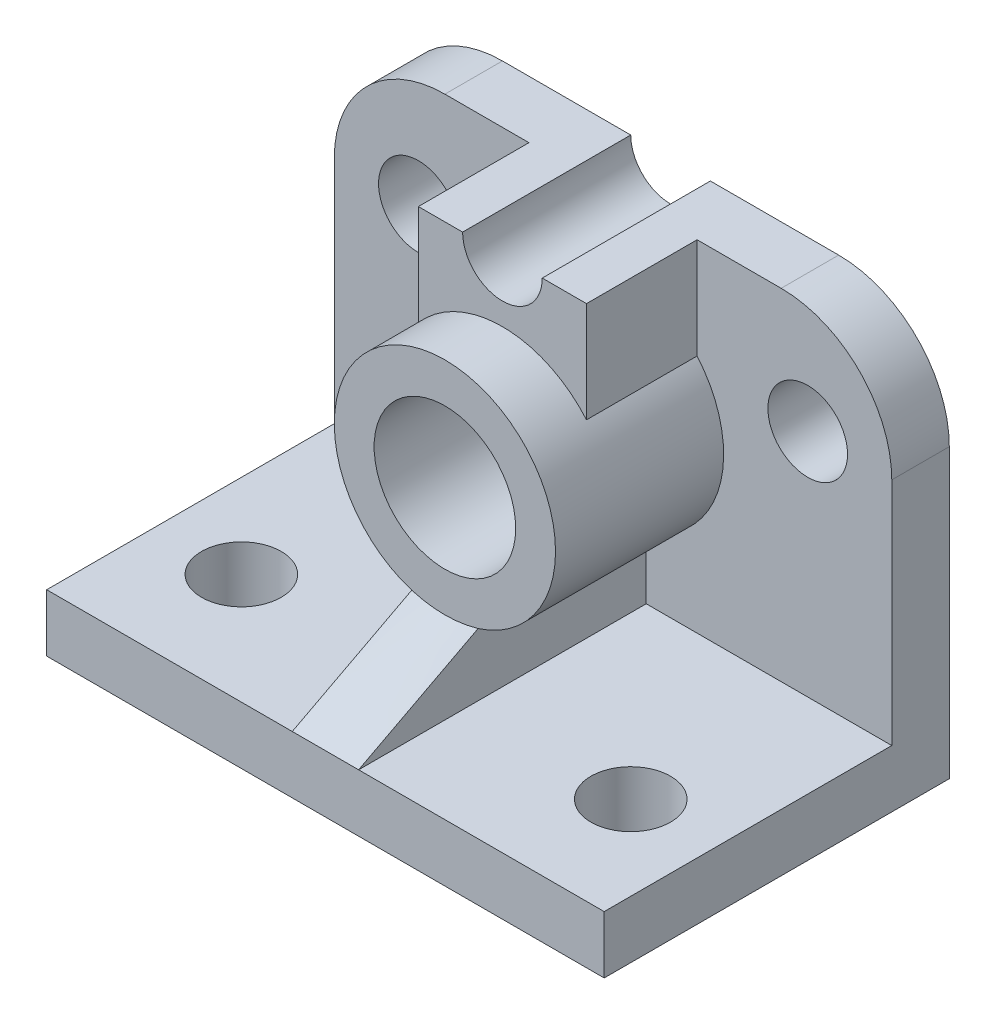
from build123d import *

# Parameters (mm, degrees)
SKETCH1_W               = 63
SKETCH1_H               = 13
BOSS_EXTRUDE1_DEPTH     = 78
BOSS_EXTRUDE2_DEPTH     = 51
BOSS_EXTRUDE3_DEPTH     = 13
BOSS_EXTRUDE5_DEPTH     = 38
FILLET1_R               = 25
CUT_EXTRUDE1_DEPTH      = 135.733069437
CUT_EXTRUDE1_DEPTH_BACK = 135.733069437
SKETCH3_R               = 9
CUT_EXTRUDE2_DEPTH      = 135.733069437
CUT_EXTRUDE2_DEPTH_BACK = 135.733069437
SKETCH2_R               = 9


with BuildPart() as part:
    # Sketch1 → Boss-Extrude1 (new body)
    with BuildSketch(Plane.XY):
        with Locations((-31.5, 6.5)):
            Rectangle(SKETCH1_W, SKETCH1_H)
        with Locations((31.5, 6.5)):
            Rectangle(SKETCH1_W, SKETCH1_H)
    extrude(amount=BOSS_EXTRUDE1_DEPTH)



with BuildPart() as body_2:
    # Sketch1<3> → Boss-Extrude2 (new body)
    with BuildSketch(Plane.XY):
        with BuildLine():
            ThreePointArc((-19, 67.248076809), (-22.706848309, 40.540600405), (0, 26))
            Line((0, 26), (0, 35))
            ThreePointArc((0, 35), (-16, 51), (0, 67))
            Line((0, 67), (0, 76))
            ThreePointArc((0, 76), (-10.459399595, 73.706848309), (-19, 67.248076809))
        make_face()
        with BuildLine():
            Line((0, 35), (0, 26))
            ThreePointArc((0, 26), (17.67766953, 33.32233047), (25, 51))
            ThreePointArc((25, 51), (23.452078799, 59.660254038), (19, 67.248076809))
            ThreePointArc((19, 67.248076809), (10.459399595, 73.706848309), (0, 76))
            Line((0, 76), (0, 67))
            ThreePointArc((0, 67), (11.313708499, 62.313708499), (16, 51))
            ThreePointArc((16, 51), (11.313708499, 39.686291501), (0, 35))
        make_face()
    extrude(amount=BOSS_EXTRUDE2_DEPTH)


with BuildPart() as part_1:
    add(part.part)

    add(body_2.part)  # Boss-Extrude3 merges body 2
    # Sketch1<5> → Boss-Extrude3 (add)
    with BuildSketch(Plane.XY):
        with BuildLine():
            Line((0, 13), (63, 13))
            Line((63, 13), (63, 90))
            Line((63, 90), (19, 90))
            Line((19, 90), (19, 67.248076809))
            ThreePointArc((19, 67.248076809), (23.452078799, 59.660254038), (25, 51))
            ThreePointArc((25, 51), (17.67766953, 33.32233047), (0, 26))
            Line((0, 26), (0, 13))
        make_face()
        with BuildLine():
            Line((-63, 13), (0, 13))
            Line((0, 13), (0, 26))
            ThreePointArc((0, 26), (-22.706848309, 40.540600405), (-19, 67.248076809))
            Line((-19, 67.248076809), (-19, 90))
            Line((-19, 90), (-63, 90))
            Line((-63, 90), (-63, 13))
        make_face()
    extrude(amount=BOSS_EXTRUDE3_DEPTH)

    # Sketch1<7> → Boss-Extrude5 (add)
    with BuildSketch(Plane.XY):
        with BuildLine():
            Line((-19, 90), (-19, 67.248076809))
            ThreePointArc((-19, 67.248076809), (-10.459399595, 73.706848309), (0, 76))
            Line((0, 76), (0, 81))
            ThreePointArc((0, 81), (-6.363961031, 83.636038969), (-9, 90))
            Line((-9, 90), (-19, 90))
        make_face()
        with BuildLine():
            Line((19, 67.248076809), (19, 90))
            Line((19, 90), (9, 90))
            ThreePointArc((9, 90), (6.363961031, 83.636038969), (0, 81))
            Line((0, 81), (0, 76))
            ThreePointArc((0, 76), (10.459399595, 73.706848309), (19, 67.248076809))
        make_face()
    extrude(amount=BOSS_EXTRUDE5_DEPTH)

    # Fillet1
    fillet1_edges = [part_1.edges().sort_by_distance(p)[0] for p in [
        (-63, 90, 6.5),
        (63, 90, 6.5),
    ]]
    fillet(fillet1_edges, radius=FILLET1_R)

    # Sketch3 → Cut-Extrude1 (cut, two sides: drawn at the far end of the back side and taken through both)
    with BuildSketch(Plane(origin=(0, 0, 0), x_dir=(1, 0, 0), z_dir=(0, 1, 0)).offset(-CUT_EXTRUDE1_DEPTH_BACK)):
        with Locations(Location((-44, -53, 0), (0, 0, 270))):
            Circle(SKETCH3_R)
        with Locations(Location((44, -53, 0), (0, 0, 270))):
            Circle(SKETCH3_R)
    extrude(amount=CUT_EXTRUDE1_DEPTH + CUT_EXTRUDE1_DEPTH_BACK, mode=Mode.SUBTRACT)

    # Sketch2 → Cut-Extrude2 (cut, two sides: drawn at the far end of the back side and taken through both)
    with BuildSketch(Plane.XY.offset(-CUT_EXTRUDE2_DEPTH_BACK)):
        with Locations((-44, 65)):
            Circle(SKETCH2_R)
        with Locations((44, 65)):
            Circle(SKETCH2_R)
    extrude(amount=CUT_EXTRUDE2_DEPTH + CUT_EXTRUDE2_DEPTH_BACK, mode=Mode.SUBTRACT)

    # Sketch13 → Loft1 section 0
    with BuildSketch(Plane(origin=(-7.5, 0, 0), x_dir=(0, 0, -1), z_dir=(1, 0, 0))):
        with BuildLine():
            Line((-78, 13), (-13, 13))
            Line((-13, 13), (-13, 27.151519965))
            Line((-13, 27.151519965), (-51, 27.151519965))
            Line((-51, 27.151519965), (-78, 13))
        make_face()
    # Sketch5 → Loft1 section 1
    with BuildSketch(Plane(origin=(0, 0, 0), x_dir=(0, 0, -1), z_dir=(1, 0, 0))):
        with BuildLine():
            Line((-78, 13), (-51, 26.066063348))
            Line((-51, 26.066063348), (-13, 26))
            Line((-13, 26), (-13, 13))
            Line((-13, 13), (-78, 13))
        make_face()
    # Sketch12 → Loft1 section 2
    with BuildSketch(Plane(origin=(7.5, 0, 0), x_dir=(0, 0, -1), z_dir=(1, 0, 0))):
        with BuildLine():
            Line((-51, 27.151519965), (-78, 13))
            Line((-78, 13), (-13, 13))
            Line((-13, 13), (-13, 27.151519965))
            Line((-13, 27.151519965), (-51, 27.151519965))
        make_face()
    loft()


solid = part_1.part
